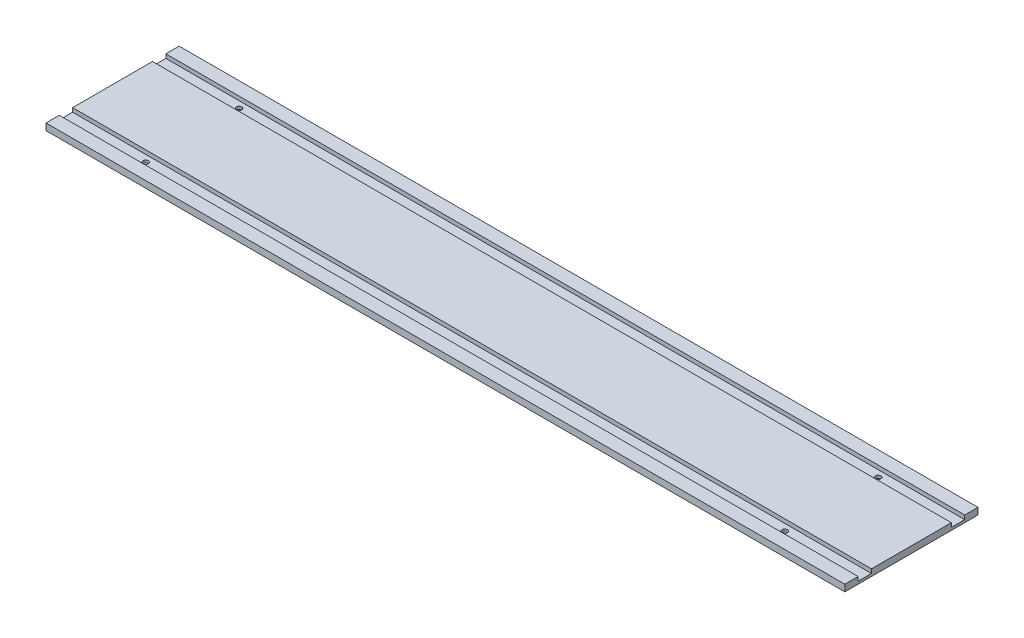
from build123d import *

# Parameters (mm, degrees)
SKETCH1_W           = 600
SKETCH1_H           = 5
BOSS_EXTRUDE1_DEPTH = 100
SKETCH5_W           = 600
SKETCH5_H           = 10
CUT_EXTRUDE1_DEPTH  = 3
SKETCH6_R           = 2
CUT_EXTRUDE2_DEPTH  = 609.296802556


with BuildPart() as part:
    # Sketch1 → Boss-Extrude1 (new body)
    with BuildSketch(Plane.XY):
        with Locations((300, 2.5)):
            Rectangle(SKETCH1_W, SKETCH1_H)
    extrude(amount=-BOSS_EXTRUDE1_DEPTH)

    # Sketch5 → Cut-Extrude1 (cut)
    with BuildSketch(Plane(origin=(0, 5, 0), x_dir=(1, 0, 0), z_dir=(0, 1, 0))):
        with Locations((300, 85)):
            Rectangle(SKETCH5_W, SKETCH5_H)
        with Locations((300, 15)):
            Rectangle(SKETCH5_W, SKETCH5_H)
    extrude(amount=-CUT_EXTRUDE1_DEPTH, mode=Mode.SUBTRACT)

    # Sketch6 → Cut-Extrude2 (cut, through all)
    with BuildSketch(Plane(origin=(0, 5, 0), x_dir=(1, 0, 0), z_dir=(0, 1, 0))):
        with Locations(Location((60, 85, 0), (0, 0, 180))):
            Circle(SKETCH6_R)
        with Locations(Location((60, 15, 0), (0, 0, 180))):
            Circle(SKETCH6_R)
        with Locations(Location((540, 85, 0), (0, 0, 180))):
            Circle(SKETCH6_R)
        with Locations(Location((540, 15, 0), (0, 0, 180))):
            Circle(SKETCH6_R)
    extrude(amount=-CUT_EXTRUDE2_DEPTH, mode=Mode.SUBTRACT)


solid = part.part
